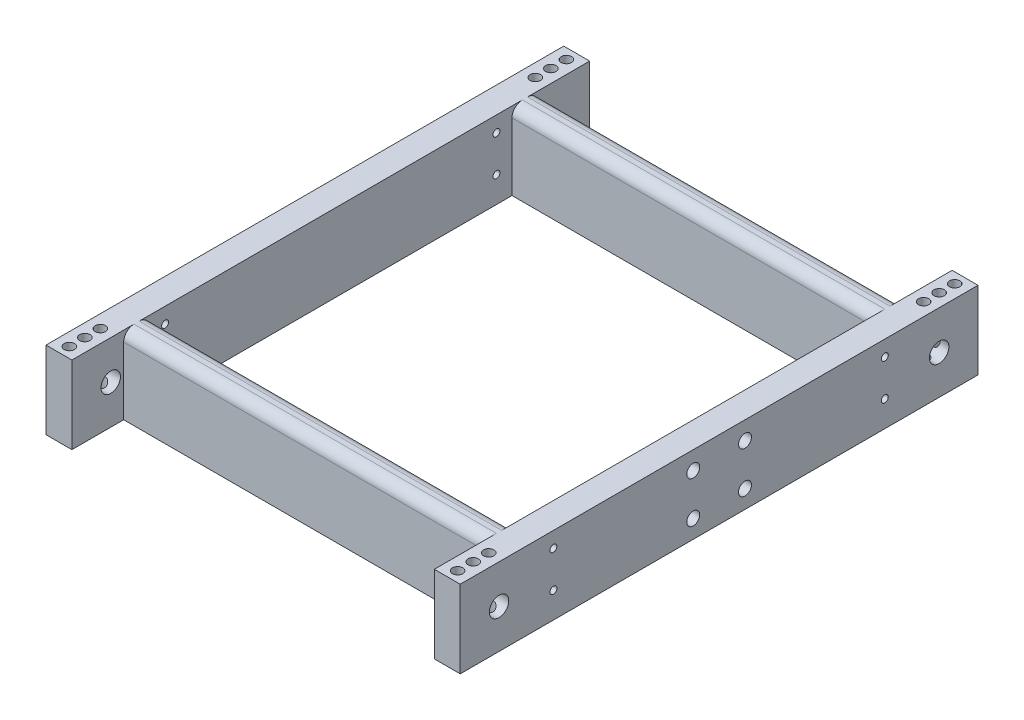
from build123d import *

# Parameters (mm, degrees)
SKETCH1_R           = 2.54
SKETCH1_W           = 177.8
SKETCH1_H           = 177.8
BOSS_EXTRUDE1_DEPTH = 38.1
SKETCH2_R           = 4.7625
SKETCH2_R_2         = 1.7
CUT_EXTRUDE1_DEPTH  = 443.23
SKETCH4_R           = 3.175
CUT_EXTRUDE2_DEPTH  = 22.606
FILLET1_R           = 5.08


with BuildPart() as part:
    # Sketch1 → Boss-Extrude1 (new body)
    with BuildSketch(Plane(origin=(0, 0, 0), x_dir=(1, 0, 0), z_dir=(0, 1, 0))):
        Polygon((88.9, 101.6), (88.9, 127), (101.6, 127), (101.6, 88.9), (101.6, -88.9), (101.6, -127), (88.9, -127), (88.9, -101.6), (-88.9, -101.6), (-88.9, -127), (-101.6, -127), (-101.6, -88.9), (-101.6, 88.9), (-101.6, 127), (-88.9, 127), (-88.9, 101.6), align=None)
        with Locations(Location((-95.25, 114.3, 0), (0, 0, 90))):
            Circle(SKETCH1_R, mode=Mode.SUBTRACT)
        with Locations(Location((95.25, 114.3, 0), (0, 0, 90))):
            Circle(SKETCH1_R, mode=Mode.SUBTRACT)
        with Locations(Location((95.25, -114.3, 0), (0, 0, 90))):
            Circle(SKETCH1_R, mode=Mode.SUBTRACT)
        with Locations(Location((-95.25, -114.3, 0), (0, 0, 90))):
            Circle(SKETCH1_R, mode=Mode.SUBTRACT)
        with Locations(Location((-95.25, 121.92, 0), (0, 0, 90))):
            Circle(SKETCH1_R, mode=Mode.SUBTRACT)
        with Locations(Location((-95.25, 106.68, 0), (0, 0, 90))):
            Circle(SKETCH1_R, mode=Mode.SUBTRACT)
        with Locations(Location((95.25, 106.68, 0), (0, 0, 90))):
            Circle(SKETCH1_R, mode=Mode.SUBTRACT)
        with Locations(Location((95.25, 121.92, 0), (0, 0, 90))):
            Circle(SKETCH1_R, mode=Mode.SUBTRACT)
        with Locations(Location((95.25, -106.68, 0), (0, 0, 90))):
            Circle(SKETCH1_R, mode=Mode.SUBTRACT)
        with Locations(Location((95.25, -121.92, 0), (0, 0, 90))):
            Circle(SKETCH1_R, mode=Mode.SUBTRACT)
        with Locations(Location((-95.25, -121.92, 0), (0, 0, 90))):
            Circle(SKETCH1_R, mode=Mode.SUBTRACT)
        with Locations(Location((-95.25, -106.68, 0), (0, 0, 90))):
            Circle(SKETCH1_R, mode=Mode.SUBTRACT)
        Rectangle(SKETCH1_W, SKETCH1_H, mode=Mode.SUBTRACT)
    extrude(amount=BOSS_EXTRUDE1_DEPTH)

    # Sketch2 → Cut-Extrude1 (cut)
    with BuildSketch(Plane.ZY.offset(101.6)):
        with Locations((-107.95, 19.147020921)):
            Circle(SKETCH2_R)
        with Locations((107.95, 19.147020921)):
            Circle(SKETCH2_R)
        with Locations((-81.28, 30.48)):
            Circle(SKETCH2_R_2)
        with Locations((-81.28, 12.7)):
            Circle(SKETCH2_R_2)
        with Locations(Location((81.28, 12.7, 0), (0, 0, 180))):
            Circle(SKETCH2_R_2)
        with Locations(Location((81.28, 30.48, 0), (0, 0, 180))):
            Circle(SKETCH2_R_2)
    extrude(amount=-CUT_EXTRUDE1_DEPTH, mode=Mode.SUBTRACT)

    # Sketch4 → Cut-Extrude2 (cut)
    with BuildSketch(Plane(origin=(101.6, 0, 0), x_dir=(0, 0, -1), z_dir=(1, 0, 0))):
        with Locations((-12.7, 8.89)):
            Circle(SKETCH4_R)
        with Locations(Location((12.7, 8.89, 0), (0, 0, 180))):
            Circle(SKETCH4_R)
        with Locations((12.7, 29.21)):
            Circle(SKETCH4_R)
        with Locations(Location((-12.7, 29.21, 0), (0, 0, 180))):
            Circle(SKETCH4_R)
    extrude(amount=-CUT_EXTRUDE2_DEPTH, mode=Mode.SUBTRACT)

    # Fillet1
    fillet1_edges = [part.edges().sort_by_distance(p)[0] for p in [
        (0, 38.1, -101.6),
        (0, 38.1, -88.9),
        (0, 38.1, 88.9),
        (0, 38.1, 101.6),
    ]]
    fillet(fillet1_edges, radius=FILLET1_R)


solid = part.part
